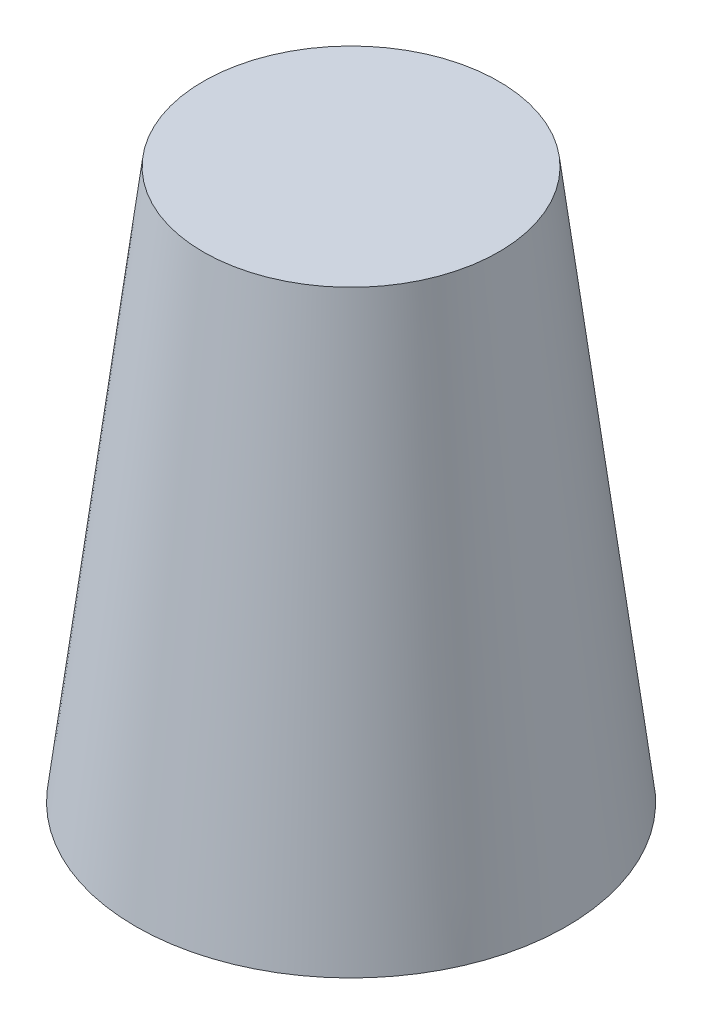
from build123d import *

# Parameters (mm, degrees)
SKETCH2_R           = 90
BOSS_EXTRUDE1_DEPTH = 230
BOSS_EXTRUDE1_TAPER = 7
SKETCH3_R           = 85
CUT_EXTRUDE1_DEPTH  = 220
CUT_EXTRUDE1_DRAFT  = -7


with BuildPart() as part:
    # Sketch2 → Boss-Extrude1 (new body)
    with BuildSketch(Plane(origin=(0, 0, 0), x_dir=(1, 0, 0), z_dir=(0, 1, 0))):
        Circle(SKETCH2_R)
    extrude(amount=BOSS_EXTRUDE1_DEPTH, taper=BOSS_EXTRUDE1_TAPER)


with BuildPart() as cut_extrude1_tool:
    # Sketch3 → Cut-Extrude1 (with draft: the straight prism first)
    with BuildSketch(Plane.XZ):
        Circle(SKETCH3_R)
    extrude(amount=-CUT_EXTRUDE1_DEPTH)
    # Cut-Extrude1: the draft: its side faces are tilted about the plane it starts from
    cut_extrude1_sides = [cut_extrude1_tool.faces().sort_by_distance(p)[0] for p in [
        (-85, 110, 0),
    ]]
    draft(cut_extrude1_sides, Plane.XZ, CUT_EXTRUDE1_DRAFT)


with BuildPart() as part_1:
    add(part.part)

    # Cut-Extrude1: cut by cut_extrude1_tool
    add(cut_extrude1_tool.part, mode=Mode.SUBTRACT)


solid = part_1.part
